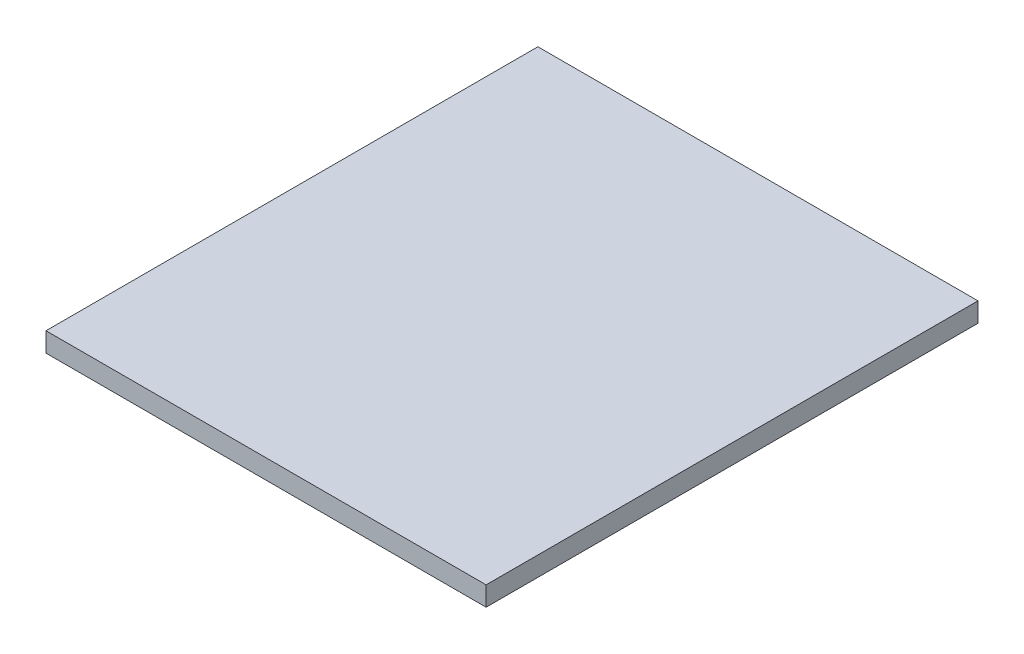
from build123d import *

# Parameters (mm, degrees)
SKETCH1_W           = 680
SKETCH1_H           = 760
BOSS_EXTRUDE1_DEPTH = 30


with BuildPart() as part:
    # Sketch1 → Boss-Extrude1 (new body)
    with BuildSketch(Plane(origin=(0, 0, 0), x_dir=(1, 0, 0), z_dir=(0, 1, 0))):
        Rectangle(SKETCH1_W, SKETCH1_H)
    extrude(amount=BOSS_EXTRUDE1_DEPTH)


solid = part.part
